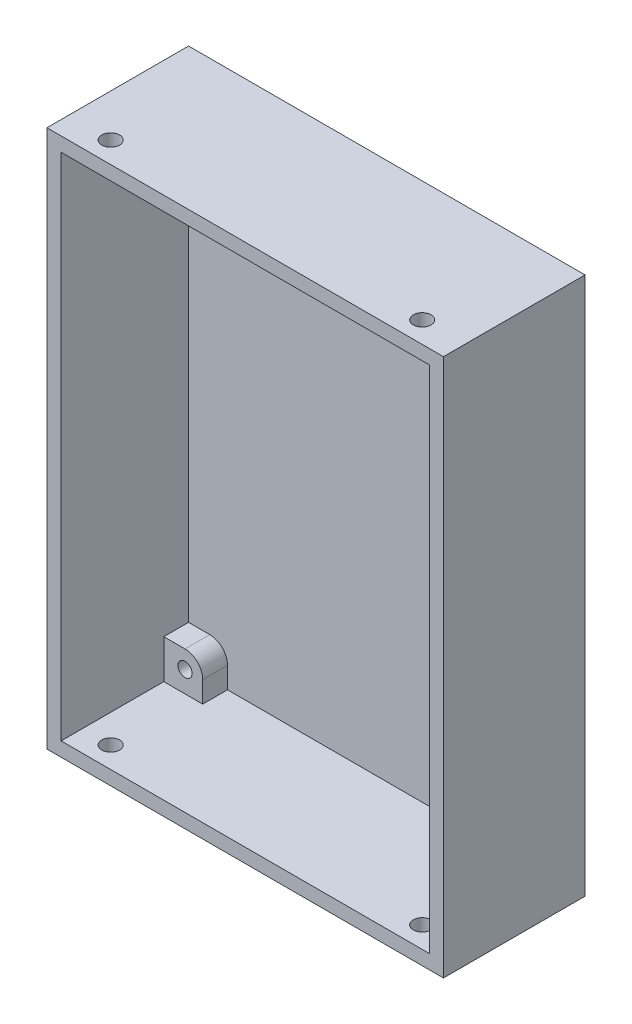
from build123d import *

# Parameters (mm, degrees)
ESBO_O1_W                 = 56
ESBO_O1_H                 = 76
RESSALTO_EXTRUS_O1_DEPTH  = 2
ESBO_O1_3_W               = 56
ESBO_O1_3_H               = 76
ESBO_O1_3_W_2             = 52
ESBO_O1_3_H_2             = 72
RESSALTO_EXTRUS_O2_DEPTH  = 18
ESBO_O2_R                 = 1
RESSALTO_EXTRUS_O3_DEPTH  = 3.5
ESPELHAR2_COPY_1_SKETCH_R = 1
ESPELHAR2_COPY_1_DEPTH    = 3.5
ESPELHAR2_COPY_2_SKETCH_R = 1
ESPELHAR2_COPY_2_DEPTH    = 3.5
ESBO_O3_R                 = 1.25
CORTE_EXTRUS_O1_DEPTH     = 83.969874051


with BuildPart() as part:
    # Esboço1 → Ressalto-extrusão1 (new body)
    with BuildSketch(Plane.XY):
        Rectangle(ESBO_O1_W, ESBO_O1_H)
    extrude(amount=-RESSALTO_EXTRUS_O1_DEPTH)

    # Esboço1<3> → Ressalto-extrusão2 (add)
    with BuildSketch(Plane.XY):
        Rectangle(ESBO_O1_3_W, ESBO_O1_3_H)
        Rectangle(ESBO_O1_3_W_2, ESBO_O1_3_H_2, mode=Mode.SUBTRACT)
    extrude(amount=RESSALTO_EXTRUS_O2_DEPTH)

    # Esboço2 → Ressalto-extrusão3 (add)
    with BuildSketch(Plane.XY):
        with BuildLine():
            Line((-26, 30.5), (-23, 30.5))
            ThreePointArc((-23, 30.5), (-21.232233047, 31.232233047), (-20.5, 33))
            Line((-20.5, 33), (-20.5, 36))
            Line((-20.5, 36), (-26, 36))
            Line((-26, 36), (-26, 30.5))
        make_face()
        with Locations((-23, 33)):
            Circle(ESBO_O2_R, mode=Mode.SUBTRACT)
    ressalto_extrus_o3 = extrude(amount=RESSALTO_EXTRUS_O3_DEPTH)

    # Espelhar1: Ressalto-extrusão3 across plane
    add(ressalto_extrus_o3.mirror(Plane(origin=(0, 0, 0), x_dir=(0, 0, 1), z_dir=(1, 0, 0))))

    # Espelhar2 copy 1 sketch → Espelhar2 copy 1 (add)
    with BuildSketch(Plane(origin=(0, 0, 0), x_dir=(-1, 0, 0), z_dir=(0, 0, 1))):
        with BuildLine():
            Line((-26, 30.5), (-23, 30.5))
            ThreePointArc((-23, 30.5), (-21.232233047, 31.232233047), (-20.5, 33))
            Line((-20.5, 33), (-20.5, 36))
            Line((-20.5, 36), (-26, 36))
            Line((-26, 36), (-26, 30.5))
        make_face()
        with Locations((-23, 33)):
            Circle(ESPELHAR2_COPY_1_SKETCH_R, mode=Mode.SUBTRACT)
    extrude(amount=ESPELHAR2_COPY_1_DEPTH)

    # Espelhar2 copy 2 sketch → Espelhar2 copy 2 (add)
    with BuildSketch(Plane.XY):
        with BuildLine():
            Line((-26, -30.5), (-23, -30.5))
            ThreePointArc((-23, -30.5), (-21.232233047, -31.232233047), (-20.5, -33))
            Line((-20.5, -33), (-20.5, -36))
            Line((-20.5, -36), (-26, -36))
            Line((-26, -36), (-26, -30.5))
        make_face()
        with Locations((-23, -33)):
            Circle(ESPELHAR2_COPY_2_SKETCH_R, mode=Mode.SUBTRACT)
    extrude(amount=ESPELHAR2_COPY_2_DEPTH)

    # Esboço3 → Corte-extrusão1 (cut, through all)
    with BuildSketch(Plane.XZ.offset(38)):
        with Locations((-22, 15)):
            Circle(ESBO_O3_R)
        with Locations((22, 15)):
            Circle(ESBO_O3_R)
    extrude(amount=-CORTE_EXTRUS_O1_DEPTH, mode=Mode.SUBTRACT)


solid = part.part
